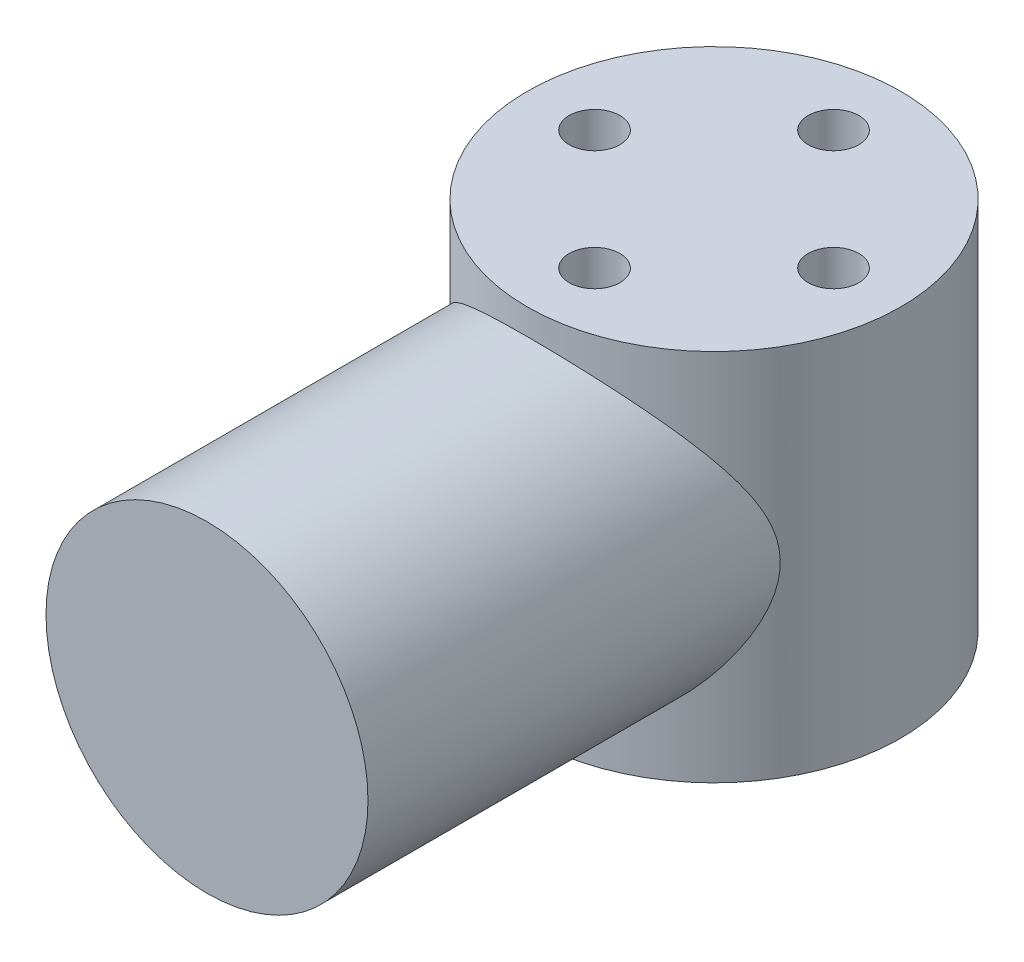
from build123d import *

# Parameters (mm, degrees)
SKETCH1_R             = 11.05
BOSS_EXTRUDE1_DEPTH   = 22.1
SKETCH4_R             = 9.525
BOSS_EXTRUDE3_DEPTH   = 30
F_3_0MM_DOWEL_HOLE1_D = 3


with BuildPart() as part:
    # Sketch1 → Boss-Extrude1 (new body)
    with BuildSketch(Plane(origin=(0, 0, 0), x_dir=(1, 0, 0), z_dir=(0, 1, 0))):
        with Locations(Location((0, 0, 0), (0, 0, 270))):
            Circle(SKETCH1_R)
    extrude(amount=BOSS_EXTRUDE1_DEPTH)

    # Sketch4 → Boss-Extrude3 (add)
    with BuildSketch(Plane.XY):
        with Locations(Location((0, 11.05, 0), (0, 0, 180))):
            Circle(SKETCH4_R)
    extrude(amount=BOSS_EXTRUDE3_DEPTH)

    # Ø3.0mm Dowel Hole1 (through all)
    with Locations(Plane(origin=(0, 0, 0), x_dir=(-1, 0, 0), z_dir=(0, -1, 0))):
        with Locations((7.07, 0), (0, 7.07), (-7.07, 0), (0, -7.07)):
            Hole(F_3_0MM_DOWEL_HOLE1_D / 2)


solid = part.part
